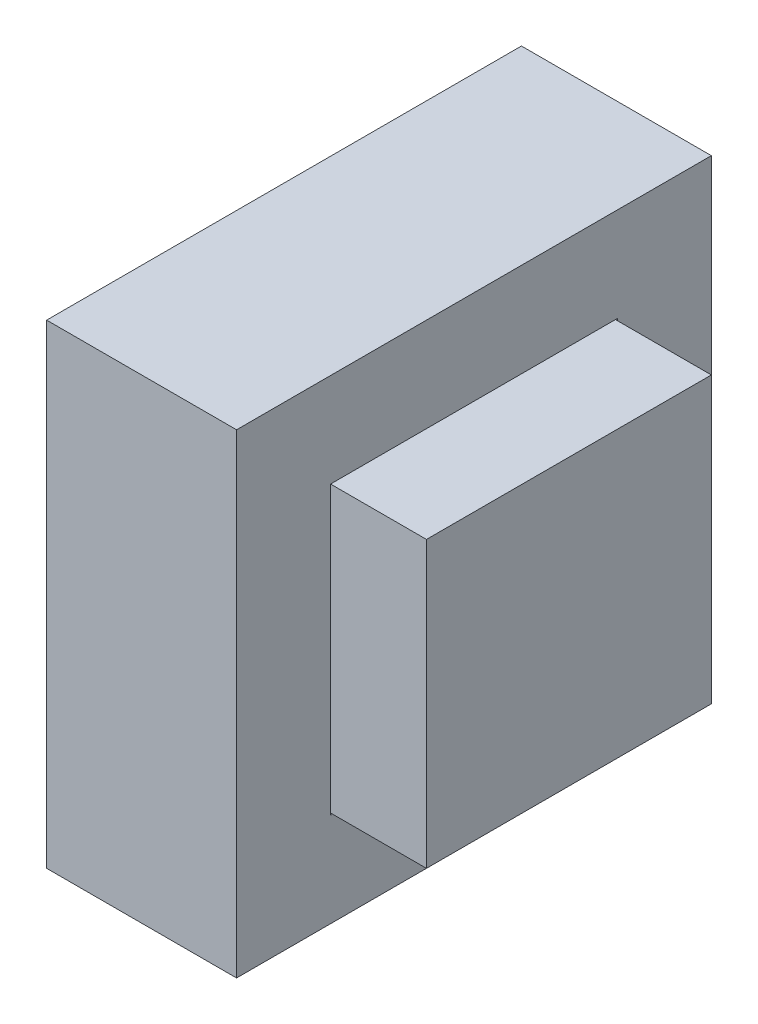
from build123d import *

# Parameters (mm, degrees)
SKETCH_1_W          = 50
SKETCH_1_H          = 50
EXTRUDE_1_DEPTH     = 20
SKETCH_2_W          = 30
SKETCH_2_H          = 30
EXTRUDE_2_DEPTH     = 10
SKETCH_3_W          = 30.2
SKETCH_3_H          = 30.2
SKETCH_3_W_2        = 30
SKETCH_3_H_2        = 30
CUT_EXTRUDE_1_DEPTH = 15


with BuildPart() as part:
    # 草图1 → 凸台-拉伸1 (new body)
    with BuildSketch(Plane(origin=(0, 0, 0), x_dir=(0, 0, -1), z_dir=(1, 0, 0))):
        Rectangle(SKETCH_1_W, SKETCH_1_H)
    extrude(amount=EXTRUDE_1_DEPTH)

    # 草图2 → 凸台-拉伸2 (add)
    with BuildSketch(Plane(origin=(20, 0, 0), x_dir=(0, 0, -1), z_dir=(1, 0, 0))):
        Rectangle(SKETCH_2_W, SKETCH_2_H)
    extrude(amount=EXTRUDE_2_DEPTH)

    # 草图3 → 切除-拉伸1 (cut)
    with BuildSketch(Plane(origin=(30, 0, 0), x_dir=(0, 0, -1), z_dir=(1, 0, 0))):
        Rectangle(SKETCH_3_W, SKETCH_3_H)
        Rectangle(SKETCH_3_W_2, SKETCH_3_H_2, mode=Mode.SUBTRACT)
    extrude(amount=-CUT_EXTRUDE_1_DEPTH, mode=Mode.SUBTRACT)


solid = part.part
